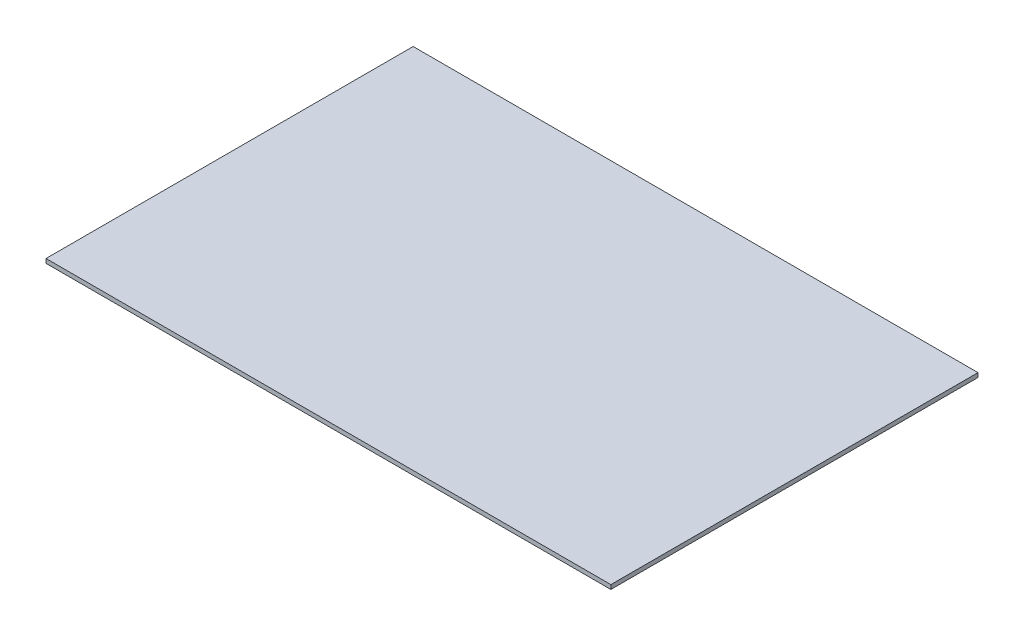
from build123d import *

# Parameters (mm, degrees)
SKETCH_1_W      = 200
SKETCH_1_H      = 130
EXTRUDE_1_DEPTH = 1.5


with BuildPart() as part:
    # Эскиз1 → Бобышка-Вытянуть1 (new body)
    with BuildSketch(Plane(origin=(0, 0, 0), x_dir=(1, 0, 0), z_dir=(0, 1, 0))):
        with Locations((100, 65)):
            Rectangle(SKETCH_1_W, SKETCH_1_H)
    extrude(amount=EXTRUDE_1_DEPTH)


solid = part.part
